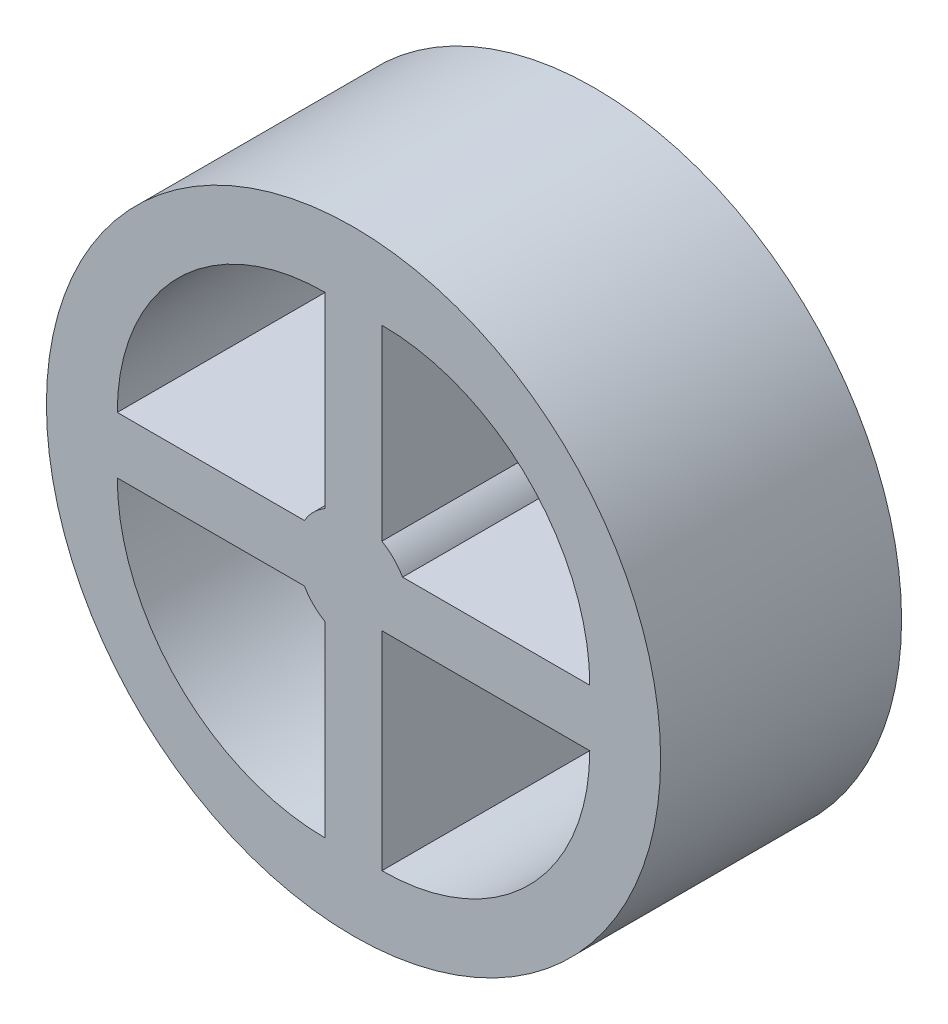
from build123d import *

# Parameters (mm, degrees)
SKETCH_1_R          = 325
EXTRUDE_1_DEPTH     = 255
CUT_EXTRUDE_2_DEPTH = 255
CUT_EXTRUDE_3_DEPTH = 255
CUT_EXTRUDE_7_DEPTH = 255
CUT_EXTRUDE_8_DEPTH = 255
CUT_EXTRUDE_6_DEPTH = 255


with BuildPart() as part:
    # 草图1 → 凸台-拉伸1 (new body)
    with BuildSketch(Plane.XY):
        Circle(SKETCH_1_R)
    extrude(amount=EXTRUDE_1_DEPTH)

    # 草图2 → 切除-拉伸2 (cut)
    with BuildSketch(Plane.XY):
        with BuildLine():
            Line((51.961524227, 30), (250, 30))
            ThreePointArc((250, 30), (185.563491861, 185.563491861), (30, 250))
            Line((30, 250), (30, 51.961524227))
            ThreePointArc((30, 51.961524227), (42.426406871, 42.426406871), (51.961524227, 30))
        make_face()
    extrude(amount=CUT_EXTRUDE_2_DEPTH, mode=Mode.SUBTRACT)

    # 草图3 → 切除-拉伸3 (cut)
    with BuildSketch(Plane.XY):
        with BuildLine():
            Line((-30, 250), (-30, 51.961524227))
            ThreePointArc((-30, 51.961524227), (-42.426406871, 42.426406871), (-51.961524227, 30))
            Line((-51.961524227, 30), (-250, 30))
            ThreePointArc((-250, 30), (-185.563491861, 185.563491861), (-30, 250))
        make_face()
    extrude(amount=CUT_EXTRUDE_3_DEPTH, mode=Mode.SUBTRACT)

    # 草图9 → 切除-拉伸7 (cut)
    with BuildSketch(Plane.XY):
        with BuildLine():
            Line((-30, -51.961524227), (-30, -250))
            ThreePointArc((-30, -250), (-185.563491861, -185.563491861), (-250, -30))
            Line((-250, -30), (-51.961524227, -30))
            ThreePointArc((-51.961524227, -30), (-42.426406871, -42.426406871), (-30, -51.961524227))
        make_face()
    extrude(amount=CUT_EXTRUDE_7_DEPTH, mode=Mode.SUBTRACT)

    # 草图10 → 切除-拉伸8 (cut)
    with BuildSketch(Plane.XY):
        with BuildLine():
            Line((30, -30), (250, -30))
            ThreePointArc((250, -30), (185.563491861, -185.563491861), (30, -250))
            Line((30, -250), (30, -30))
        make_face()
    extrude(amount=CUT_EXTRUDE_8_DEPTH, mode=Mode.SUBTRACT)

    # 草图8 → 切除-拉伸6 (cut)
    with BuildSketch(Plane.XY):
        with BuildLine():
            Line((30, -30), (30, -250))
            ThreePointArc((30, -250), (185.563491861, -185.563491861), (250, -30))
            Line((250, -30), (30, -30))
        make_face()
    extrude(amount=CUT_EXTRUDE_6_DEPTH, mode=Mode.SUBTRACT)


solid = part.part
